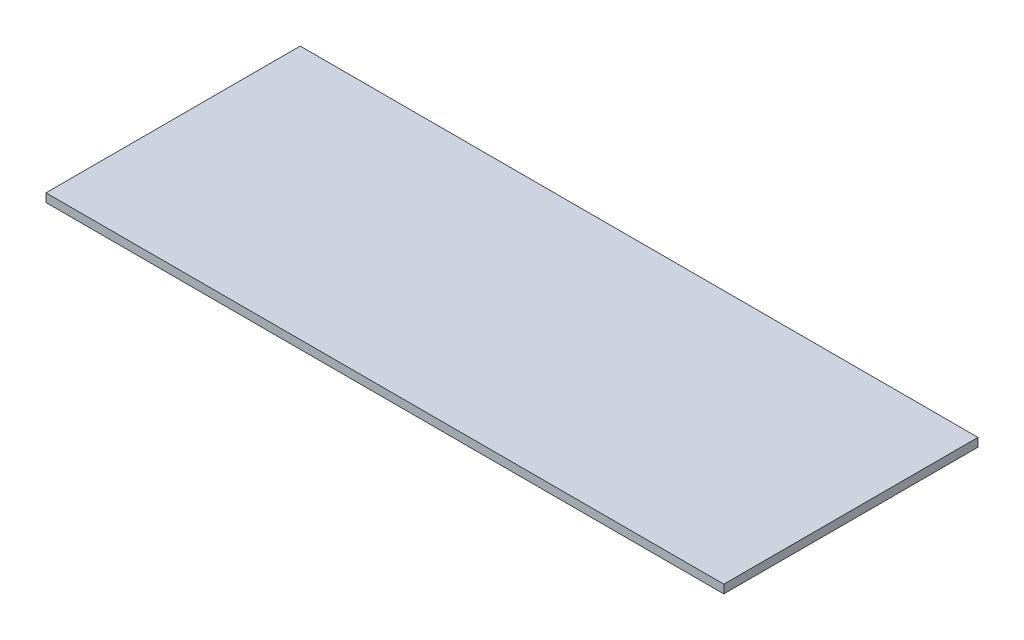
from build123d import *

# Parameters (mm, degrees)
SKETCH_1_W      = 203.2
SKETCH_1_H      = 76.2
EXTRUDE_1_DEPTH = 2.54


with BuildPart() as part:
    # 草图1 → 凸台-拉伸1 (new body)
    with BuildSketch(Plane(origin=(0, 0, 0), x_dir=(1, 0, 0), z_dir=(0, 1, 0))):
        with Locations((101.6, -38.1)):
            Rectangle(SKETCH_1_W, SKETCH_1_H)
    extrude(amount=EXTRUDE_1_DEPTH)


solid = part.part
